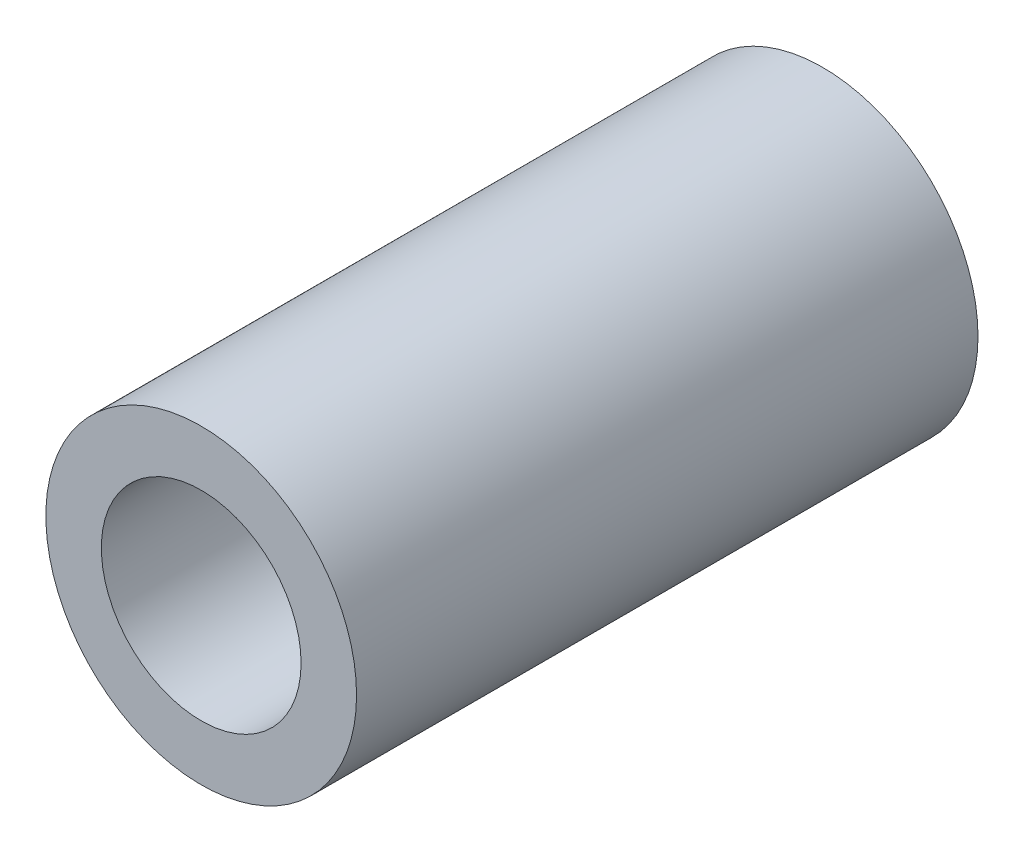
from build123d import *

# Parameters (mm, degrees)
CROQUIS1_R              = 7
CROQUIS1_R_2            = 4.5
SALIENTE_EXTRUIR1_DEPTH = 28


with BuildPart() as part:
    # Croquis1 → Saliente-Extruir1 (new body)
    with BuildSketch(Plane.XY):
        Circle(CROQUIS1_R)
        Circle(CROQUIS1_R_2, mode=Mode.SUBTRACT)
    extrude(amount=SALIENTE_EXTRUIR1_DEPTH)


solid = part.part
